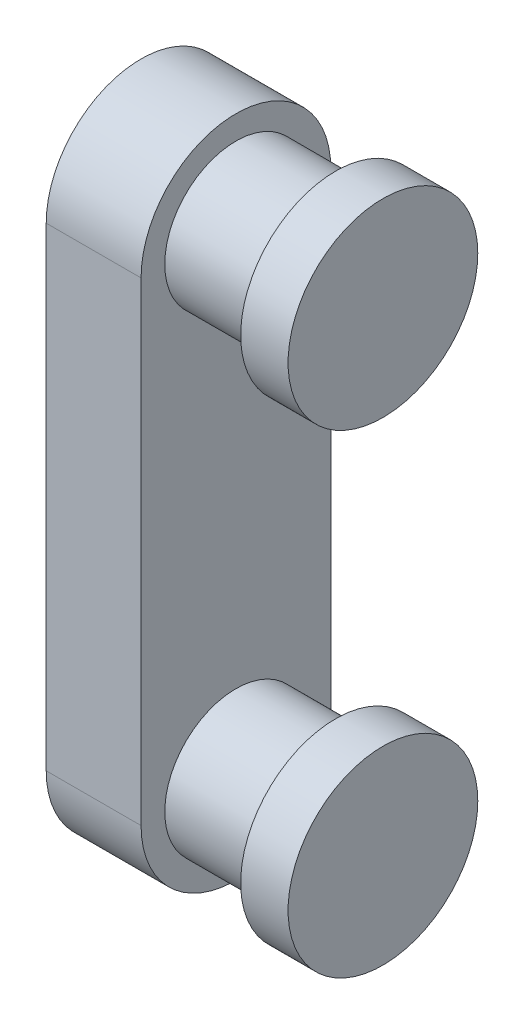
from build123d import *

# Parameters (mm, degrees)
BASE_DEPTH         = 2
ESQUISSE2_R        = 1.5
BOSS_FIX_DEPTH     = 2.1
ESQUISSE3_R        = 2
BOSS_BLOCAGE_DEPTH = 1


with BuildPart() as part:
    # Esquisse1 → BASE (new body)
    with BuildSketch(Plane(origin=(0, 0, 0), x_dir=(0, 0, -1), z_dir=(1, 0, 0))):
        with BuildLine():
            Line((2, 5), (2, -5))
            ThreePointArc((2, -5), (0, -7), (-2, -5))
            Line((-2, -5), (-2, 5))
            ThreePointArc((-2, 5), (0, 7), (2, 5))
        make_face()
    extrude(amount=BASE_DEPTH)

    # Esquisse2 → BOSS FIX (add)
    with BuildSketch(Plane(origin=(2, 0, 0), x_dir=(0, 0, -1), z_dir=(1, 0, 0))):
        with Locations(Location((0, 5, 0), (0, 0, 180))):
            Circle(ESQUISSE2_R)
    boss_fix = extrude(amount=BOSS_FIX_DEPTH)

    # Esquisse3 → BOSS BLOCAGE (add)
    with BuildSketch(Plane(origin=(4.1, 0, 0), x_dir=(0, 0, -1), z_dir=(1, 0, 0))):
        with Locations((0, 5)):
            Circle(ESQUISSE3_R)
    boss_blocage = extrude(amount=BOSS_BLOCAGE_DEPTH)

    # SYM FIXATION: BOSS FIX, BOSS BLOCAGE across plane
    add(boss_fix.mirror(Plane.ZX))
    add(boss_blocage.mirror(Plane.ZX))


solid = part.part
